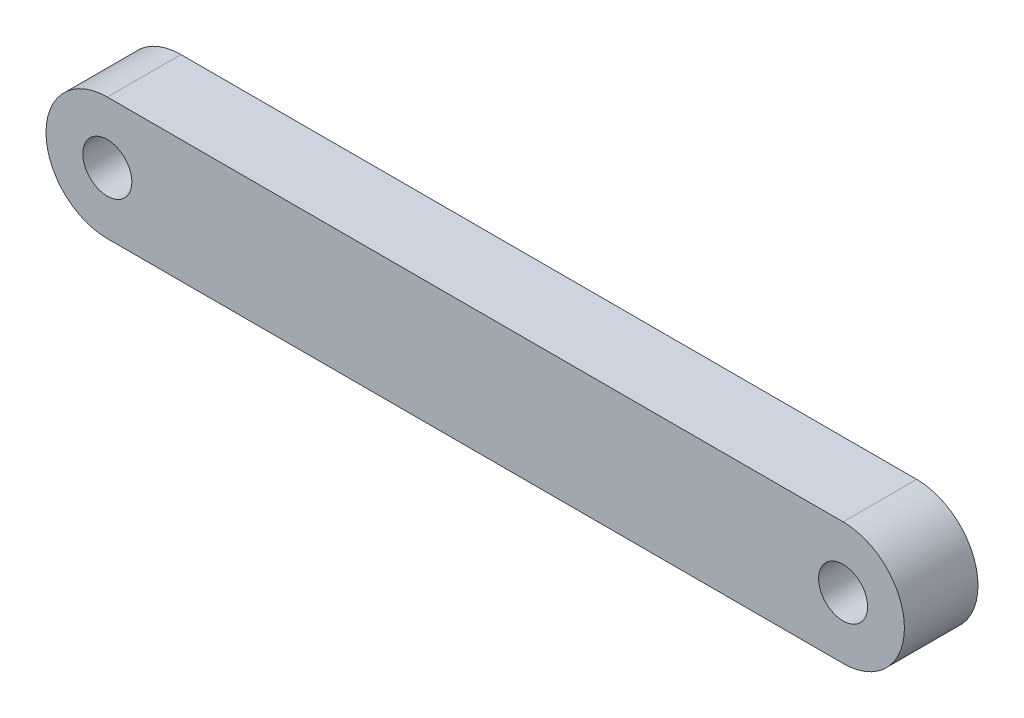
from build123d import *

# Parameters (mm, degrees)
SKETCH_1_R      = 1
EXTRUDE_1_DEPTH = 3


with BuildPart() as part:
    # 草图1 → 凸台-拉伸1 (new body)
    with BuildSketch(Plane.XY):
        with BuildLine():
            Line((0, 2.5), (30, 2.5))
            ThreePointArc((30, 2.5), (32.5, 0), (30, -2.5))
            Line((30, -2.5), (0, -2.5))
            ThreePointArc((0, -2.5), (-2.5, 0), (0, 2.5))
        make_face()
        Circle(SKETCH_1_R, mode=Mode.SUBTRACT)
        with Locations((30, 0)):
            Circle(SKETCH_1_R, mode=Mode.SUBTRACT)
    extrude(amount=EXTRUDE_1_DEPTH)


solid = part.part
